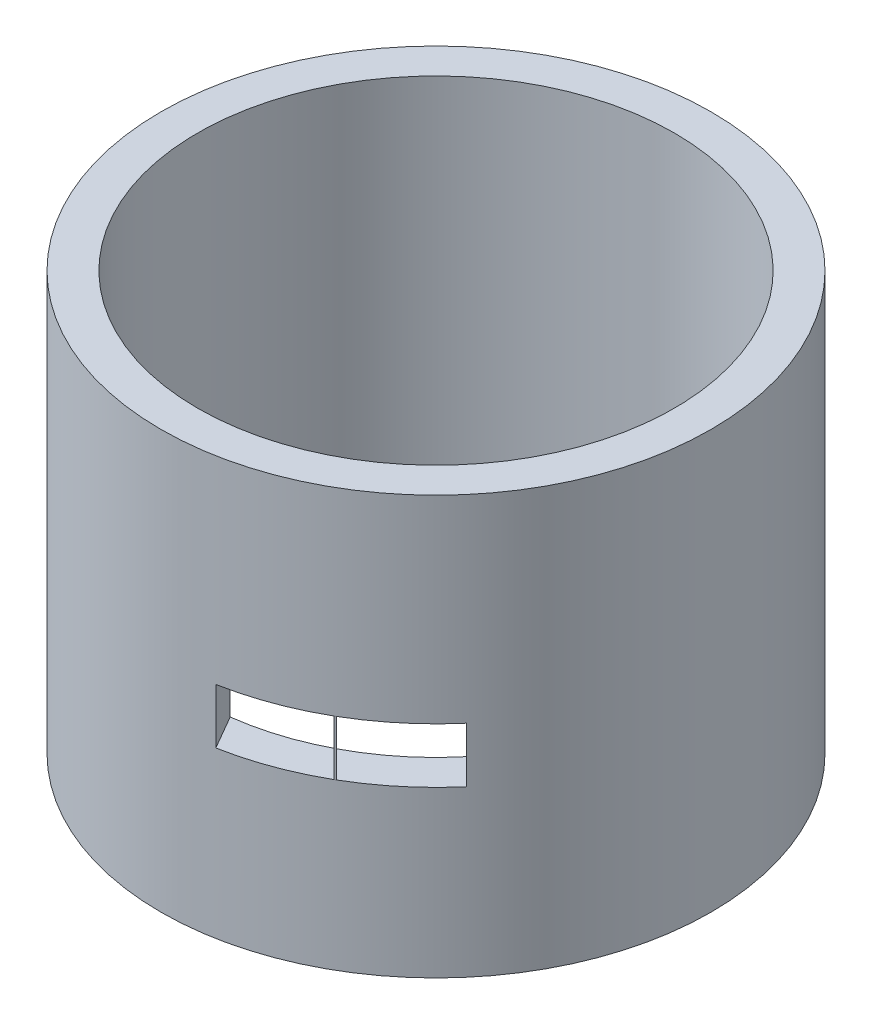
from build123d import *

# Parameters (mm, degrees)
SKETCH1_R           = 75
BOSS_EXTRUDE1_DEPTH = 114
SKETCH2_R           = 65
CUT_EXTRUDE1_DEPTH  = 120
SKETCH3_W           = 50
SKETCH3_H           = 15
CUT_EXTRUDE2_DEPTH  = 15


with BuildPart() as part:
    # Sketch1 → Boss-Extrude1 (new body)
    with BuildSketch(Plane(origin=(0, 0, 0), x_dir=(1, 0, 0), z_dir=(0, 1, 0))):
        with Locations(Location((0, 0, 0), (0, 0, 90))):
            Circle(SKETCH1_R)
    extrude(amount=BOSS_EXTRUDE1_DEPTH)

    # Sketch2 → Cut-Extrude1 (cut)
    with BuildSketch(Plane(origin=(0, 114, 0), x_dir=(1, 0, 0), z_dir=(0, 1, 0))):
        with Locations(Location((0, 0, 0), (0, 0, 270))):
            Circle(SKETCH2_R)
    extrude(amount=-CUT_EXTRUDE1_DEPTH, mode=Mode.SUBTRACT)

    # Sketch3 → Cut-Extrude2 (cut)
    with BuildSketch(Plane(origin=(37.49973472, 0, 64.951445805), x_dir=(0.8660254037844382, 0, -0.5000000000000011), z_dir=(0.5000000000000011, 6.982962677686268e-15, 0.8660254037844382))):
        with Locations((0, 52.5)):
            Rectangle(SKETCH3_W, SKETCH3_H)
    extrude(amount=-CUT_EXTRUDE2_DEPTH, mode=Mode.SUBTRACT)


solid = part.part
